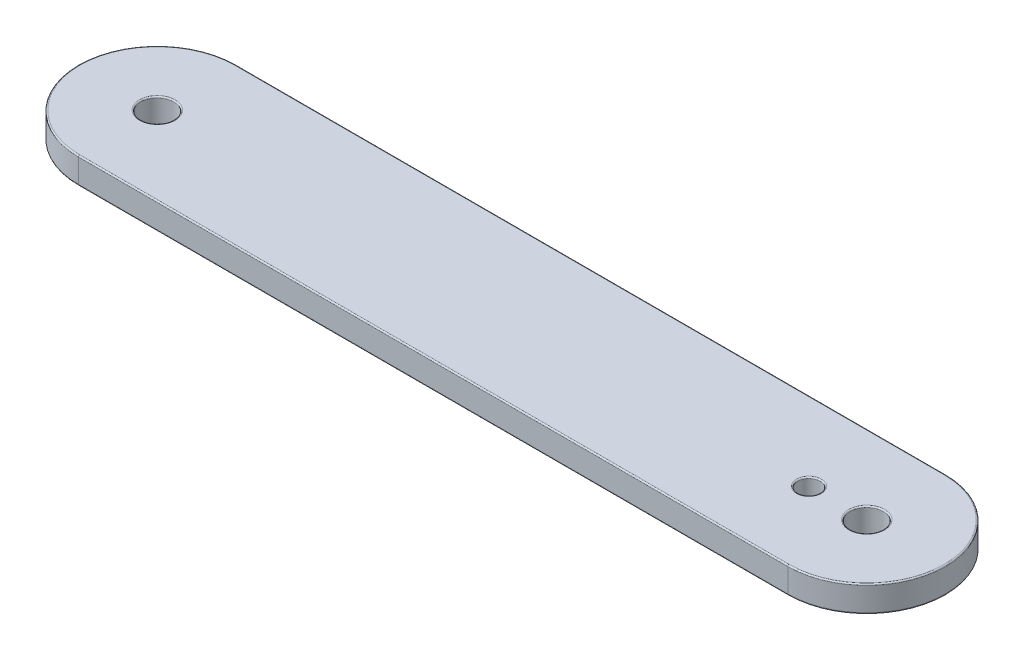
from build123d import *

# Parameters (mm, degrees)
SKETCH1_R           = 4
SKETCH1_R_2         = 2.7
BOSS_EXTRUDE1_DEPTH = 6.35
FILLET1_R           = 0.3175


with BuildPart() as part:
    # Sketch1 → Boss-Extrude1 (new body)
    with BuildSketch(Plane(origin=(0, 0, 0), x_dir=(1, 0, 0), z_dir=(0, 1, 0))):
        with BuildLine():
            Line((0, -19.05), (-171.45, -19.05))
            ThreePointArc((-171.45, -19.05), (-190.5, 0), (-171.45, 19.05))
            Line((-171.45, 19.05), (0, 19.05))
            ThreePointArc((0, 19.05), (19.05, 0), (0, -19.05))
        make_face()
        with Locations(Location((-171.45, 0, 0), (0, 0, 270))):
            Circle(SKETCH1_R, mode=Mode.SUBTRACT)
        with Locations(Location((0, 0, 0), (0, 0, 270))):
            Circle(SKETCH1_R, mode=Mode.SUBTRACT)
        with Locations(Location((-13.97, 0, 0), (0, 0, 270))):
            Circle(SKETCH1_R_2, mode=Mode.SUBTRACT)
    extrude(amount=BOSS_EXTRUDE1_DEPTH)

    # Fillet1
    fillet1_edges = [part.edges().sort_by_distance(p)[0] for p in [
        (-190.5, 6.35, 0),
        (-171.45, 0, -4),
        (-171.45, 6.35, -4),
        (-85.725, 6.35, 19.05),
        (0, 0, -4),
        (0, 6.35, -4),
        (-13.97, 0, -2.7),
        (-13.97, 6.35, -2.7),
        (19.05, 6.35, 0),
        (-85.725, 0, 19.05),
        (-190.5, 0, 0),
        (-85.725, 0, -19.05),
        (19.05, 0, 0),
        (-85.725, 6.35, -19.05),
    ]]
    fillet(fillet1_edges, radius=FILLET1_R)


solid = part.part
